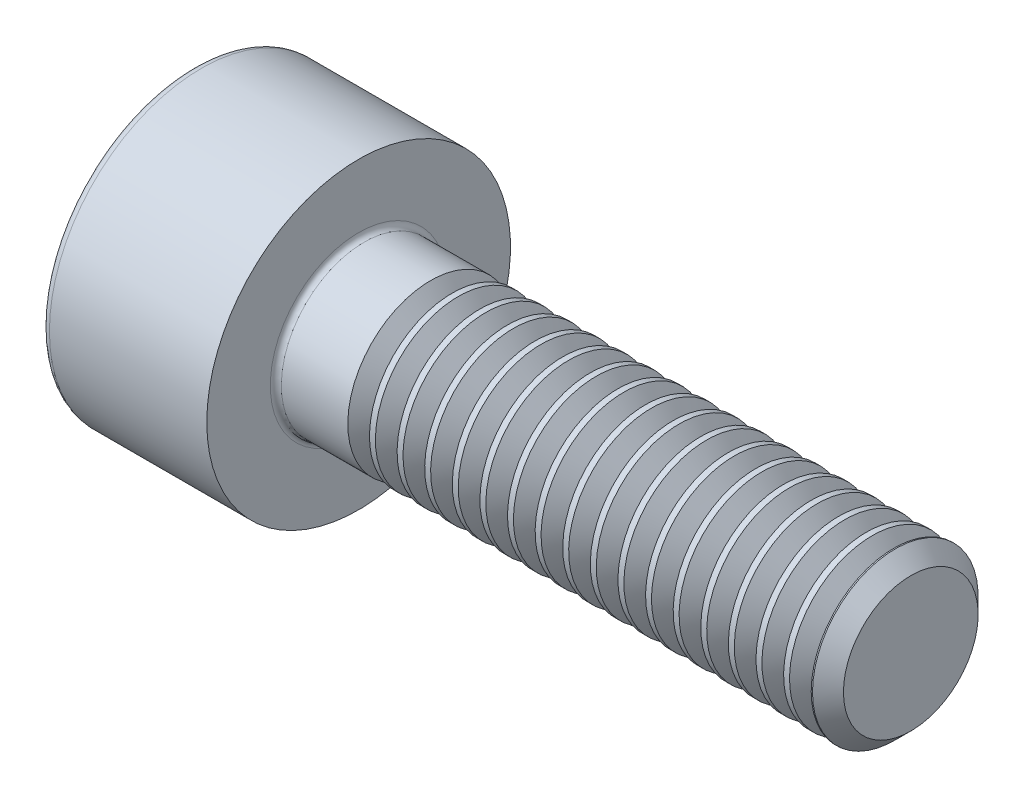
from build123d import *

# Parameters (mm, degrees)
FILLET1_R       = 0.1
FILLET2_R       = 0.15
HEX_2_DEPTH     = 1.3
THDSCHPAT_COUNT = 17
THDSCHPAT_PITCH = 0.5


with BuildPart() as part:
    # BodySke → Base-Revolve (revolve)
    with BuildSketch(Plane.XY, mode=Mode.PRIVATE) as base_revolve_sk:
        Polygon((0, 0), (0, 2.75), (3, 2.75), (3, 1.5), (12.7195, 1.5), (13, 1.2195), (13, 0), align=None)
    revolve(base_revolve_sk.sketch.rotate(Axis((-31.75, 0, 0), (1, 0, 0)), 90), axis=Axis((-31.75, 0, 0), (1, 0, 0)))

    # Fillet1
    fillet1_edges = [part.edges().sort_by_distance(p)[0] for p in [
        (3, 0, -1.5),
    ]]
    fillet(fillet1_edges, radius=FILLET1_R)

    # Fillet2
    fillet2_edges = [part.edges().sort_by_distance(p)[0] for p in [
        (0, 0, -2.75),
    ]]
    fillet(fillet2_edges, radius=FILLET2_R)

    # Sketch2 → Hex-PreBroach (revolve, cut)
    with BuildSketch(Plane.XY, mode=Mode.PRIVATE) as hex_prebroach_sk:
        Polygon((0, 1.28), (1.3, 1.28), (2.039008345, 0), (0, 0), align=None)
    revolve(hex_prebroach_sk.sketch.rotate(Axis((0, 0, 0), (1, 0, 0)), 90), axis=Axis((0, 0, 0), (1, 0, 0)), mode=Mode.SUBTRACT)

    # Sketch3 → Hex 2 (cut)
    with BuildSketch(Plane(origin=(0, 0, 0), x_dir=(0, 0.500000000000001, 0.866025403784438), z_dir=(-1, 0, 0))):
        Polygon((0.739008345, 1.28), (-0.739008345, 1.28), (-1.478016689, 0), (-0.739008345, -1.28), (0.739008345, -1.28), (1.478016689, 0), align=None)
    extrude(amount=-HEX_2_DEPTH, mode=Mode.SUBTRACT)

    # ThdSchSke → ThreadSchematic (revolve, cut)
    with BuildSketch(Plane.XY):
        Polygon((4.5, -1.2195), (4.303591786, -1.5), (4.303591786, -1.875), (4.696408214, -1.875), (4.696408214, -1.5), align=None)
    threadschematic = revolve(axis=Axis((-3.175, 0, 0), (1, 0, 0)), mode=Mode.SUBTRACT)

    # ThdSchPat: ThreadSchematic ×17
    with Locations(*[(i * THDSCHPAT_PITCH, 0, 0) for i in range(1, THDSCHPAT_COUNT)]):
        add(threadschematic, mode=Mode.SUBTRACT)


solid = part.part
